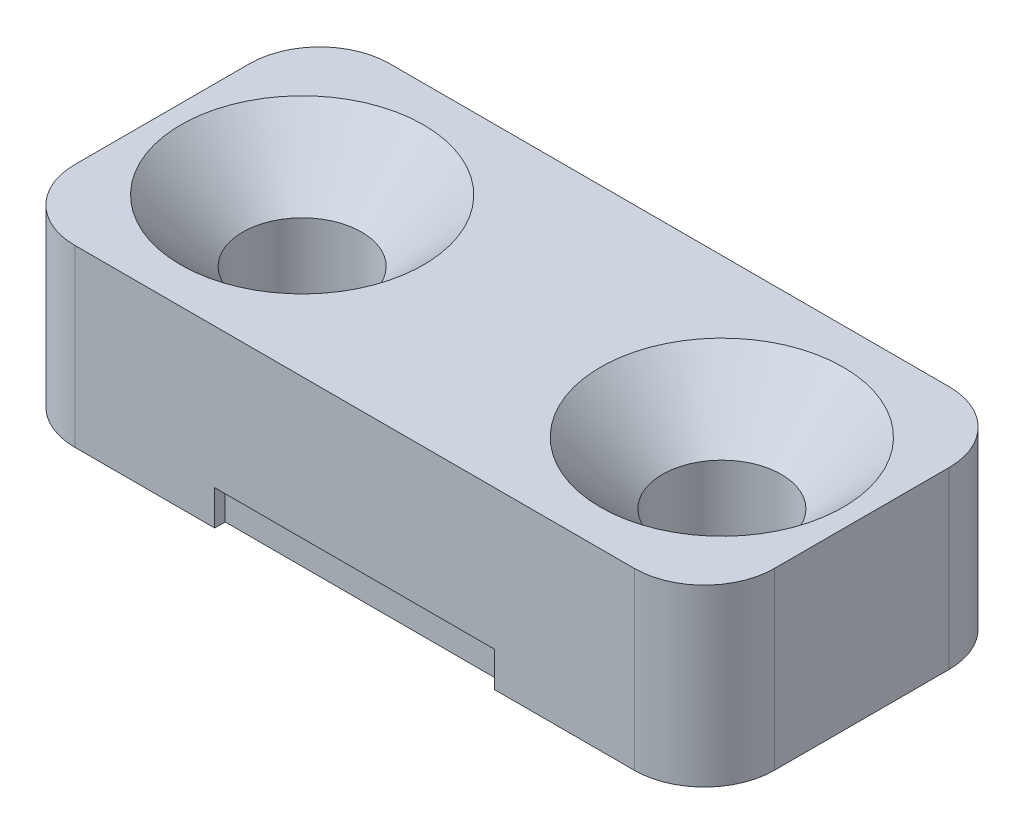
from build123d import *

# Parameters (mm, degrees)
BOSS_EXTRUDE1_DEPTH                                  = 5
CSK_FOR_M3_HEX_SOCKET_COUNTERSUNK_HEAD_S_D           = 3.4
CSK_FOR_M3_HEX_SOCKET_COUNTERSUNK_HEAD_S_CSINK_D     = 6.94
CSK_FOR_M3_HEX_SOCKET_COUNTERSUNK_HEAD_S_CSINK_ANGLE = 90
SKETCH5_W                                            = 1.6
SKETCH5_H                                            = 1
CUT_EXTRUDE1_DEPTH                                   = 4


with BuildPart() as part:
    # Sketch1 → Boss-Extrude1 (new body)
    with BuildSketch(Plane(origin=(0, 0, 0), x_dir=(1, 0, 0), z_dir=(0, 1, 0))):
        with BuildLine():
            Line((-8, 4.5), (8, 4.5))
            ThreePointArc((8, 4.5), (9.414213562, 3.914213562), (10, 2.5))
            Line((10, 2.5), (10, -2.5))
            ThreePointArc((10, -2.5), (9.414213562, -3.914213562), (8, -4.5))
            Line((8, -4.5), (-8, -4.5))
            ThreePointArc((-8, -4.5), (-9.414213562, -3.914213562), (-10, -2.5))
            Line((-10, -2.5), (-10, 2.5))
            ThreePointArc((-10, 2.5), (-9.414213562, 3.914213562), (-8, 4.5))
        make_face()
    extrude(amount=BOSS_EXTRUDE1_DEPTH)

    # CSK for M3 Hex Socket Countersunk Head Screw1 (through all)
    with Locations(Plane(origin=(0, 5, 0), x_dir=(1, 0, 0), z_dir=(0, 1, 0))):
        with Locations((-6, 0), (6, 0)):
            CounterSinkHole(CSK_FOR_M3_HEX_SOCKET_COUNTERSUNK_HEAD_S_D / 2, CSK_FOR_M3_HEX_SOCKET_COUNTERSUNK_HEAD_S_CSINK_D / 2, counter_sink_angle=CSK_FOR_M3_HEX_SOCKET_COUNTERSUNK_HEAD_S_CSINK_ANGLE)

    # Sketch5 → Cut-Extrude1 (cut, symmetric)
    with BuildSketch(Plane(origin=(0, 0, 0), x_dir=(0, 0, -1), z_dir=(1, 0, 0))):
        with Locations((2.5, 0.5)):
            Rectangle(SKETCH5_W, SKETCH5_H)
        with Locations((-5, 0.5)):
            Rectangle(SKETCH5_W, SKETCH5_H)
        with Locations((-2.5, 0.5)):
            Rectangle(SKETCH5_W, SKETCH5_H)
        with Locations((0, 0.5)):
            Rectangle(SKETCH5_W, SKETCH5_H)
        with Locations((5, 0.5)):
            Rectangle(SKETCH5_W, SKETCH5_H)
    extrude(amount=CUT_EXTRUDE1_DEPTH, both=True, mode=Mode.SUBTRACT)


solid = part.part
